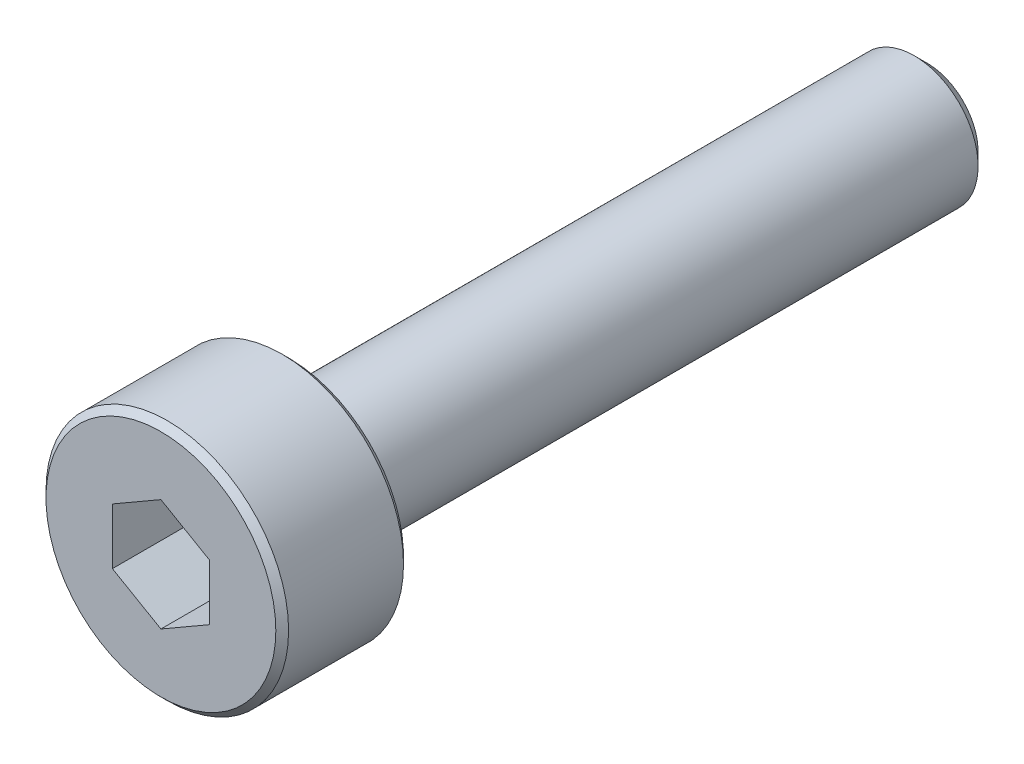
from build123d import *

# Parameters (mm, degrees)
SKETCH_1_W          = 1.9
SKETCH_1_H          = 2
SKETCH_2_R          = 1
EXTRUDE_1_DEPTH     = 10
CUT_EXTRUDE_1_DEPTH = 1.5
CHAMFER_1_SIZE2     = 0.100000822
CHAMFER_1_SIZE      = 0.100000763
CHAMFER_2_SIZE      = 0.200008364
CHAMFER_2_SIZE2     = 0.200010455


with BuildPart() as part:
    # 草图1 → 旋转1 (revolve)
    with BuildSketch(Plane(origin=(0, 0, 0), x_dir=(1, 0, 0), z_dir=(0, 1, 0))):
        with Locations((0.95, -11)):
            Rectangle(SKETCH_1_W, SKETCH_1_H)
    revolve(axis=Axis((0, 0, 10), (0, 0, 1)))

    # 草图2 → 凸台-拉伸1 (add)
    with BuildSketch(Plane(origin=(0, 0, 10), x_dir=(-1, 0, 0), z_dir=(0, 0, -1))):
        Circle(SKETCH_2_R)
    extrude(amount=EXTRUDE_1_DEPTH)

    # 草图3 → 切除-拉伸1 (cut)
    with BuildSketch(Plane.XY.offset(12)):
        Polygon((-0.76, -0.438786205), (0, -0.877572409), (0.76, -0.438786205), (0.76, 0.438786205), (0, 0.877572409), (-0.76, 0.438786205), align=None)
    extrude(amount=-CUT_EXTRUDE_1_DEPTH, mode=Mode.SUBTRACT)

    # 倒角1
    chamfer_1_edges = [part.edges().sort_by_distance(p)[0] for p in [
        (-1.9, 0, 12),
        (-1.9, 0, 10),
    ]]
    chamfer(chamfer_1_edges, length=CHAMFER_1_SIZE, length2=CHAMFER_1_SIZE2)

    # 倒角2
    chamfer_2_edges = [part.edges().sort_by_distance(p)[0] for p in [
        (1, 0, 0),
    ]]
    chamfer_2_side = [part.faces().sort_by_distance(p)[0] for p in [
        (1, 0, 5),
    ]]
    chamfer(chamfer_2_edges, length=CHAMFER_2_SIZE, length2=CHAMFER_2_SIZE2, reference=chamfer_2_side[0])


solid = part.part
